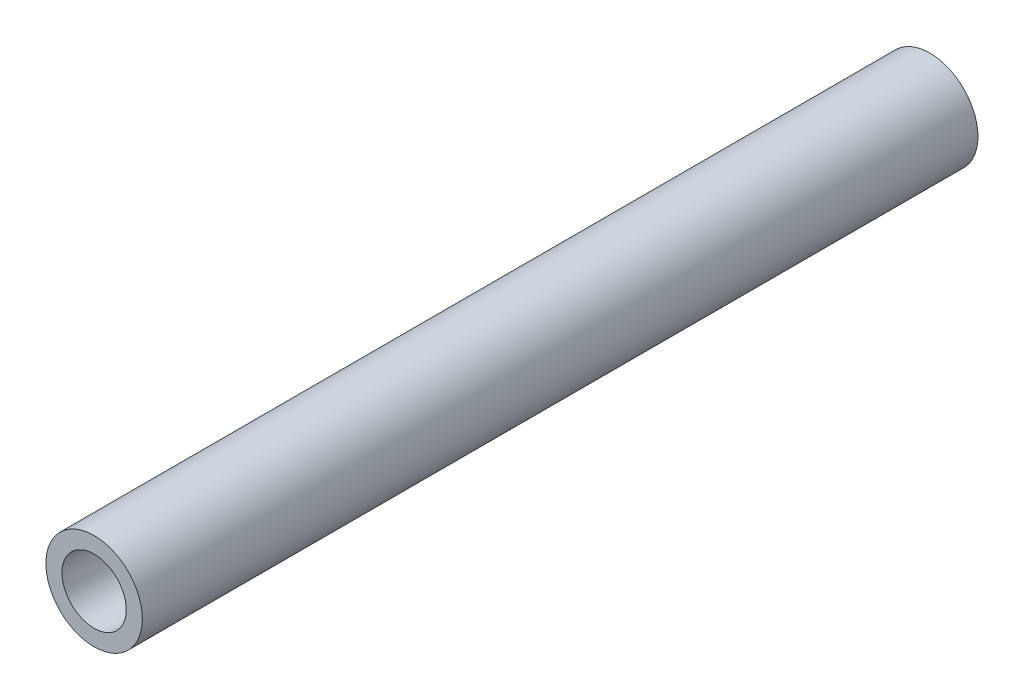
from build123d import *

# Parameters (mm, degrees)
BOSS_EXTRUDE1_DEPTH      = 65
BOSS_EXTRUDE1_DEPTH_BACK = 65
SKETCH1_R                = 7.5
SKETCH1_R_2              = 5


with BuildPart() as part:
    # Sketch1 → Boss-Extrude1 (new, two sides: drawn at the far end of the back side and taken through both)
    with BuildSketch(Plane.XY.offset(-BOSS_EXTRUDE1_DEPTH_BACK)):
        Circle(SKETCH1_R)
        Circle(SKETCH1_R_2, mode=Mode.SUBTRACT)
    extrude(amount=BOSS_EXTRUDE1_DEPTH + BOSS_EXTRUDE1_DEPTH_BACK)


solid = part.part
